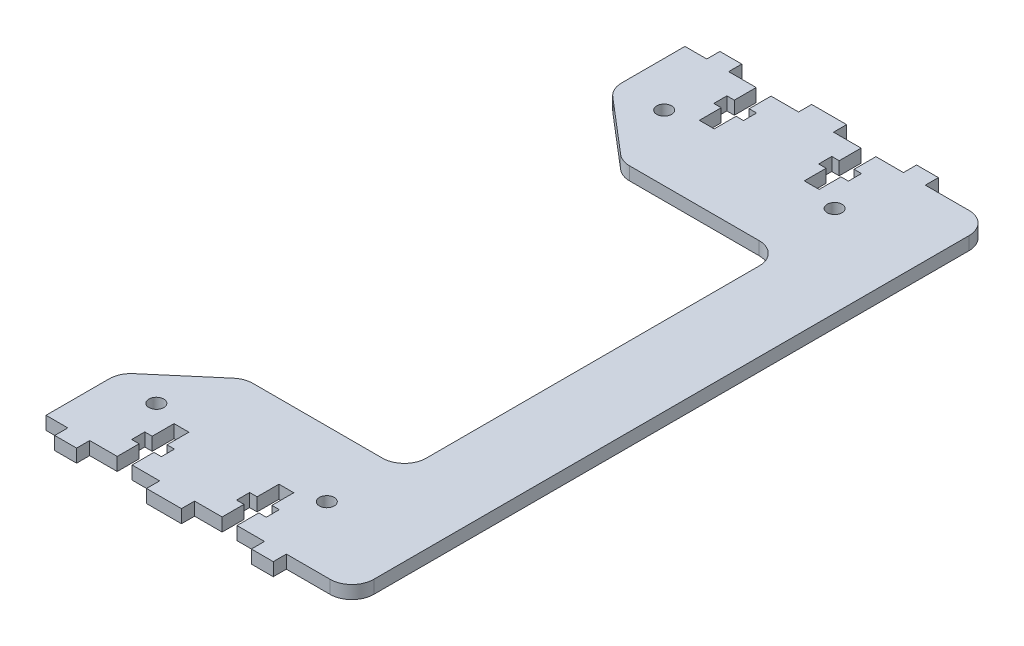
from build123d import *

# Parameters (mm, degrees)
EXTRUDE_1_DEPTH     = 3
SKETCH_2_W          = 5
SKETCH_2_H          = 3
CUT_EXTRUDE_1_DEPTH = 176
SKETCH_3_W          = 146.2
SKETCH_3_H          = 3
EXTRUDE_2_DEPTH     = 5
SKETCH_4_R          = 1.7
CUT_EXTRUDE_2_DEPTH = 5
CUT_EXTRUDE_3_DEPTH = 10
FILLET_1_R          = 5
FILLET_2_R          = 5


with BuildPart() as part:
    # 草图1 → 凸台-拉伸1 (new body)
    with BuildSketch(Plane(origin=(0, 0, 0), x_dir=(1, 0, 0), z_dir=(0, 1, 0))):
        Polygon((-25, -73.1), (-25, -76.1), (-20, -76.1), (-20, -73.1), (-13.7, -73.1), (-13.7, -68.1), (-15.4, -68.1), (-15.4, -65.1), (-13.7, -65.1), (-13.7, -60.1), (-10.3, -60.1), (-10.3, -65.1), (-8.6, -65.1), (-8.6, -68.1), (-10.3, -68.1), (-10.3, -73.1), (-4, -73.1), (-4, -76.1), (4, -76.1), (4, -73.1), (10.3, -73.1), (10.3, -68.1), (8.6, -68.1), (8.6, -65.1), (10.3, -65.1), (10.3, -60.1), (13.7, -60.1), (13.7, -65.1), (15.4, -65.1), (15.4, -68.1), (13.7, -68.1), (13.7, -73.1), (20, -73.1), (20, -76.1), (25, -76.1), (25, -73.1), (35, -73.1), (35, 73.1), (25, 73.1), (25, 76.1), (20, 76.1), (20, 73.1), (13.7, 73.1), (13.7, 68.1), (15.4, 68.1), (15.4, 65.1), (13.7, 65.1), (13.7, 60.1), (10.3, 60.1), (10.3, 65.1), (8.6, 65.1), (8.6, 68.1), (10.3, 68.1), (10.3, 73.1), (4, 73.1), (4, 76.1), (-4, 76.1), (-4, 73.1), (-10.3, 73.1), (-10.3, 68.1), (-8.6, 68.1), (-8.6, 65.1), (-10.3, 65.1), (-10.3, 60.1), (-13.7, 60.1), (-13.7, 65.1), (-15.4, 65.1), (-15.4, 68.1), (-13.7, 68.1), (-13.7, 73.1), (-20, 73.1), (-20, 76.1), (-25, 76.1), (-25, 73.1), (-35, 73.1), (-35, -73.1), align=None)
    extrude(amount=EXTRUDE_1_DEPTH)

    # 草图2 → 切除-拉伸1 (cut)
    with BuildSketch(Plane.XY.offset(73.1)):
        with Locations((-32.5, 1.5)):
            Rectangle(SKETCH_2_W, SKETCH_2_H)
    extrude(amount=-CUT_EXTRUDE_1_DEPTH, mode=Mode.SUBTRACT)

    # 草图3 → 凸台-拉伸2 (add)
    with BuildSketch(Plane(origin=(35, 0, 0), x_dir=(0, 0, -1), z_dir=(1, 0, 0))):
        with Locations((0, 1.5)):
            Rectangle(SKETCH_3_W, SKETCH_3_H)
    extrude(amount=EXTRUDE_2_DEPTH)

    # 草图4 → 切除-拉伸2 (cut)
    with BuildSketch(Plane(origin=(0, 3, 0), x_dir=(1, 0, 0), z_dir=(0, 1, 0))):
        with Locations(Location((-19.75, -58.1, 0), (0, 0, 270))):
            Circle(SKETCH_4_R)
        with Locations(Location((19.25, -58.1, 0), (0, 0, 270))):
            Circle(SKETCH_4_R)
        with Locations(Location((19.25, 58.1, 0), (0, 0, 270))):
            Circle(SKETCH_4_R)
        with Locations(Location((-19.75, 58.1, 0), (0, 0, 270))):
            Circle(SKETCH_4_R)
    extrude(amount=-CUT_EXTRUDE_2_DEPTH, mode=Mode.SUBTRACT)

    # 草图5 → 切除-拉伸3 (cut)
    with BuildSketch(Plane(origin=(0, 3, 0), x_dir=(1, 0, 0), z_dir=(0, 1, 0))):
        Polygon((-30, -56.331395183), (-14.5, -43.1), (0, -43.1), (22, -43.1), (22, 43.1), (-14.5, 43.1), (-30, 56.331395183), align=None)
    extrude(amount=-CUT_EXTRUDE_3_DEPTH, mode=Mode.SUBTRACT)

    # 圆角1
    fillet_1_edges = [part.edges().sort_by_distance(p)[0] for p in [
        (-30, 1.5, 56.331395183),
        (-30, 1.5, -56.331395183),
        (-14.5, 1.5, -43.1),
        (22, 1.5, -43.1),
        (22, 1.5, 43.1),
        (-14.5, 1.5, 43.1),
    ]]
    fillet(fillet_1_edges, radius=FILLET_1_R)

    # 圆角2
    fillet_2_edges = [part.edges().sort_by_distance(p)[0] for p in [
        (40, 1.5, 73.1),
        (40, 1.5, -73.1),
    ]]
    fillet(fillet_2_edges, radius=FILLET_2_R)


solid = part.part
